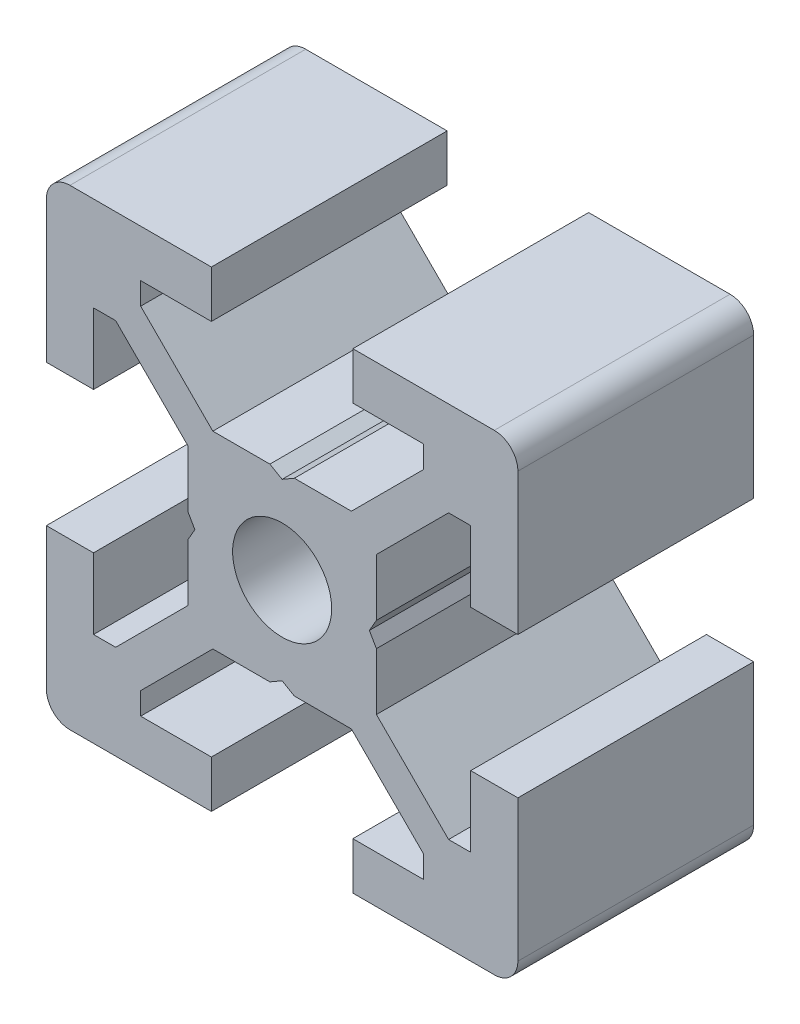
from build123d import *

# Parameters (mm, degrees)
SKETCH1_R           = 2.1
BOSS_EXTRUDE1_DEPTH = 10


with BuildPart() as part:
    # Sketch1 → Boss-Extrude1 (new body)
    with BuildSketch(Plane(origin=(0, 0, -500), x_dir=(-1, 0, 0), z_dir=(0, 0, -1))):
        with BuildLine():
            Line((9, 10), (3, 10))
            Line((3, 10), (3, 8))
            Line((3, 8), (6, 8))
            Line((6, 8), (6, 7.060660172))
            Line((6, 7.060660172), (2.939339828, 4))
            Line((2.939339828, 4), (0.519615242, 4))
            Line((0.519615242, 4), (0, 3.7))
            Line((0, 3.7), (-0.519615242, 4))
            Line((-0.519615242, 4), (-2.939339828, 4))
            Line((-2.939339828, 4), (-6, 7.060660172))
            Line((-6, 7.060660172), (-6, 8))
            Line((-6, 8), (-3, 8))
            Line((-3, 8), (-3, 10))
            Line((-3, 10), (-9, 10))
            ThreePointArc((-9, 10), (-9.707106781, 9.707106781), (-10, 9))
            Line((-10, 9), (-10, 3))
            Line((-10, 3), (-8, 3))
            Line((-8, 3), (-8, 6))
            Line((-8, 6), (-7.060660172, 6))
            Line((-7.060660172, 6), (-4, 2.939339828))
            Line((-4, 2.939339828), (-4, 0.519615242))
            Line((-4, 0.519615242), (-3.7, 0))
            Line((-3.7, 0), (-4, -0.519615242))
            Line((-4, -0.519615242), (-4, -2.939339828))
            Line((-4, -2.939339828), (-7.060660172, -6))
            Line((-7.060660172, -6), (-8, -6))
            Line((-8, -6), (-8, -3))
            Line((-8, -3), (-10, -3))
            Line((-10, -3), (-10, -9))
            ThreePointArc((-10, -9), (-9.707106781, -9.707106781), (-9, -10))
            Line((-9, -10), (-3, -10))
            Line((-3, -10), (-3, -8))
            Line((-3, -8), (-6, -8))
            Line((-6, -8), (-6, -7.060660172))
            Line((-6, -7.060660172), (-2.939339828, -4))
            Line((-2.939339828, -4), (-0.519615242, -4))
            Line((-0.519615242, -4), (0, -3.7))
            Line((0, -3.7), (0.519615242, -4))
            Line((0.519615242, -4), (2.939339828, -4))
            Line((2.939339828, -4), (6, -7.060660172))
            Line((6, -7.060660172), (6, -8))
            Line((6, -8), (3, -8))
            Line((3, -8), (3, -10))
            Line((3, -10), (9, -10))
            ThreePointArc((9, -10), (9.707106781, -9.707106781), (10, -9))
            Line((10, -9), (10, -3))
            Line((10, -3), (8, -3))
            Line((8, -3), (8, -6))
            Line((8, -6), (7.060660172, -6))
            Line((7.060660172, -6), (4, -2.939339828))
            Line((4, -2.939339828), (4, -0.519615242))
            Line((4, -0.519615242), (3.7, 0))
            Line((3.7, 0), (4, 0.519615242))
            Line((4, 0.519615242), (4, 2.939339828))
            Line((4, 2.939339828), (7.060660172, 6))
            Line((7.060660172, 6), (8, 6))
            Line((8, 6), (8, 3))
            Line((8, 3), (10, 3))
            Line((10, 3), (10, 9))
            ThreePointArc((10, 9), (9.707106781, 9.707106781), (9, 10))
        make_face()
        with Locations(Location((0, 0, 0), (0, 0, 180))):
            Circle(SKETCH1_R, mode=Mode.SUBTRACT)
    extrude(amount=-BOSS_EXTRUDE1_DEPTH)


solid = part.part
